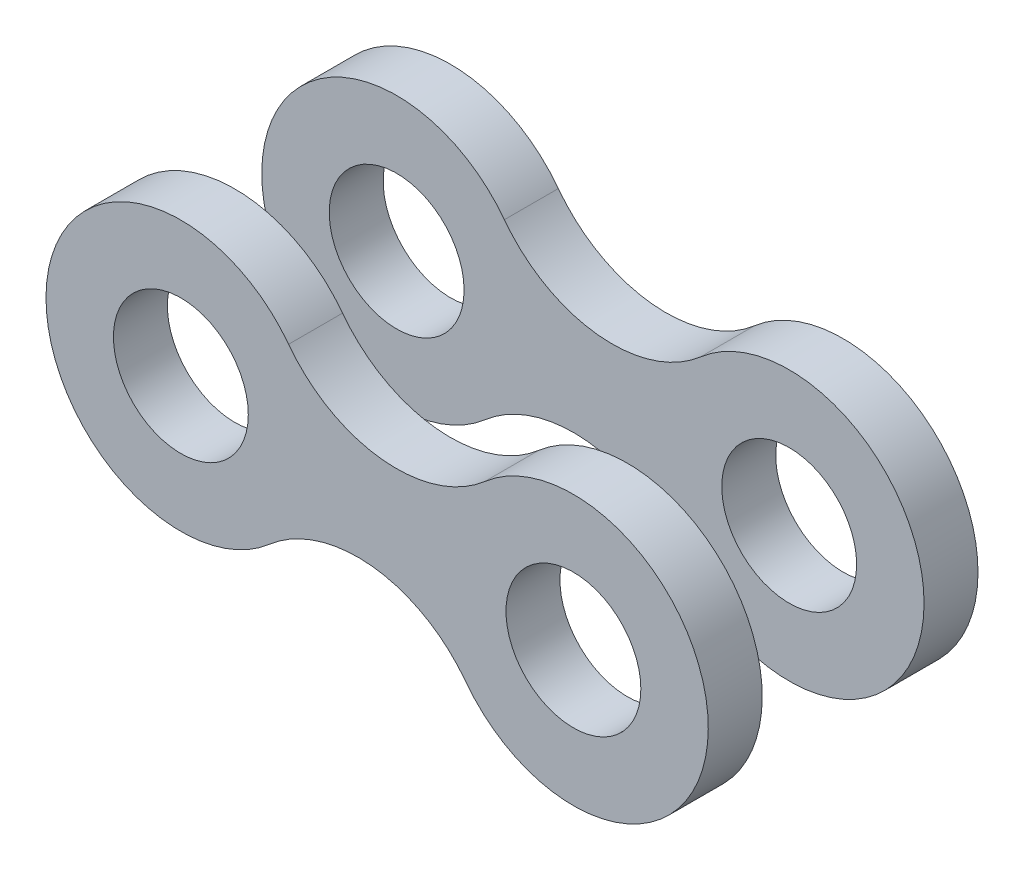
from build123d import *

# Parameters (mm, degrees)
IZIM2_R                     = 2.5
Y_KSEKLIK_EKSTR_ZYON1_DEPTH = 2
Y_KSEKLIK_EKSTR_ZYON2_START = -8
IZIM2_2_R                   = 2.5
Y_KSEKLIK_EKSTR_ZYON2_DEPTH = 2


with BuildPart() as part:
    # Çizim2 → Yükseklik-Ekstrüzyon1 (new body)
    with BuildSketch(Plane.XY):
        with BuildLine():
            ThreePointArc((10.559116328, 65.463281055), (7.087056614, 67.428839536), (3.282207149, 66.228115029))
            ThreePointArc((3.282207149, 66.228115029), (-4.972609477, 70.522642316), (3.99470203, 73.007050996))
            ThreePointArc((3.99470203, 73.007050996), (7.466761743, 71.041492516), (11.271611208, 72.242217022))
            ThreePointArc((11.271611208, 72.242217022), (19.526427834, 67.947689735), (10.559116328, 65.463281055))
        make_face()
        with Locations((0, 70)):
            Circle(IZIM2_R, mode=Mode.SUBTRACT)
        with Locations((14.553818357, 68.470332051)):
            Circle(IZIM2_R, mode=Mode.SUBTRACT)
    extrude(amount=-Y_KSEKLIK_EKSTR_ZYON1_DEPTH)


with BuildPart() as body_2:
    # Çizim2<2> → Yükseklik-Ekstrüzyon2 (new body)
    with BuildSketch(Plane.XY.offset(Y_KSEKLIK_EKSTR_ZYON2_START)):
        with BuildLine():
            ThreePointArc((10.559116328, 65.463281055), (7.087056614, 67.428839536), (3.282207149, 66.228115029))
            ThreePointArc((3.282207149, 66.228115029), (-4.972609477, 70.522642316), (3.99470203, 73.007050996))
            ThreePointArc((3.99470203, 73.007050996), (7.466761743, 71.041492516), (11.271611208, 72.242217022))
            ThreePointArc((11.271611208, 72.242217022), (19.526427834, 67.947689735), (10.559116328, 65.463281055))
        make_face()
        with Locations((0, 70)):
            Circle(IZIM2_2_R, mode=Mode.SUBTRACT)
        with Locations((14.553818357, 68.470332051)):
            Circle(IZIM2_2_R, mode=Mode.SUBTRACT)
    extrude(amount=-Y_KSEKLIK_EKSTR_ZYON2_DEPTH)


solid = Compound([part.part, body_2.part])
